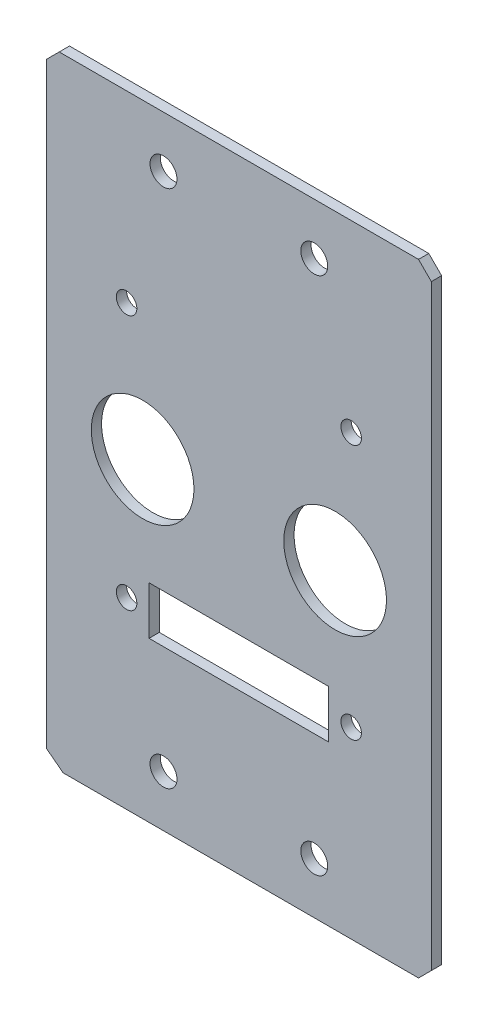
from build123d import *

# Parameters (mm, degrees)
SKETCH_1_R      = 8
SKETCH_1_R_2    = 1.6
SKETCH_1_R_3    = 2.1
SKETCH_1_W      = 28
SKETCH_1_H      = 7.5
EXTRUDE_1_DEPTH = 1.6


with BuildPart() as part:
    # 草图1 → 凸台-拉伸1 (new body)
    with BuildSketch(Plane.XY):
        Polygon((-28, 48.5), (28, 48.5), (30, 46.5), (30, -46.5), (28, -48.5), (-27.38960578, -48.5), (-30, -46.5), (-30, 46.5), align=None)
        with Locations((-15, 0)):
            Circle(SKETCH_1_R, mode=Mode.SUBTRACT)
        with Locations((-17.5, 19.9)):
            Circle(SKETCH_1_R_2, mode=Mode.SUBTRACT)
        with Locations((-11.75, 40.5)):
            Circle(SKETCH_1_R_3, mode=Mode.SUBTRACT)
        with Locations(Location((-17.5, -19.9, 0), (0, 0, 180))):
            Circle(SKETCH_1_R_2, mode=Mode.SUBTRACT)
        with Locations(Location((-11.75, -40.5, 0), (0, 0, 180))):
            Circle(SKETCH_1_R_3, mode=Mode.SUBTRACT)
        with Locations(Location((17.5, 19.9, 0), (0, 0, 180))):
            Circle(SKETCH_1_R_2, mode=Mode.SUBTRACT)
        with Locations(Location((11.75, 40.5, 0), (0, 0, 180))):
            Circle(SKETCH_1_R_3, mode=Mode.SUBTRACT)
        with Locations((11.75, -40.5)):
            Circle(SKETCH_1_R_3, mode=Mode.SUBTRACT)
        with Locations((17.5, -19.9)):
            Circle(SKETCH_1_R_2, mode=Mode.SUBTRACT)
        with Locations(Location((15, 0, 0), (0, 0, 180))):
            Circle(SKETCH_1_R, mode=Mode.SUBTRACT)
        with Locations((0, -19.9)):
            Rectangle(SKETCH_1_W, SKETCH_1_H, mode=Mode.SUBTRACT)
    extrude(amount=EXTRUDE_1_DEPTH)


solid = part.part
